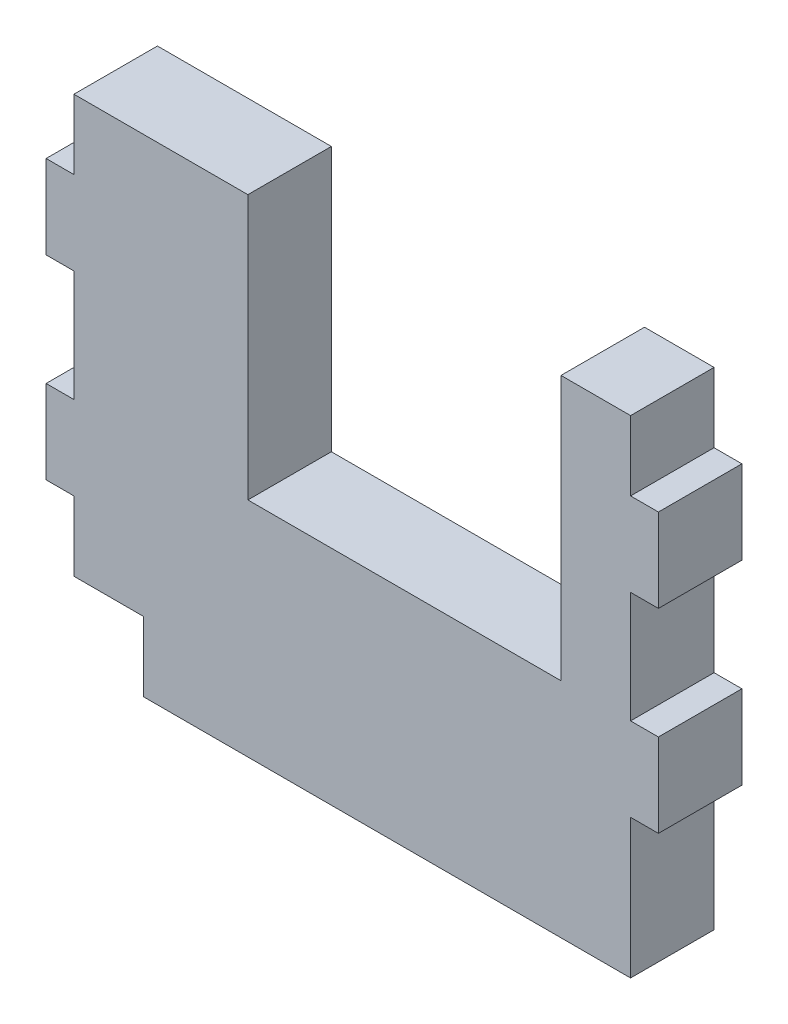
from build123d import *

# Parameters (mm, degrees)
EXTRUDE_1_DEPTH = 6


with BuildPart() as part:
    # Эскиз2 → Бобышка-Вытянуть1 (new body)
    with BuildSketch(Plane.XY):
        Polygon((35, 35), (40, 35), (40, 30), (42, 30), (42, 24), (40, 24), (40, 16), (42, 16), (42, 10), (40, 10), (40, 0), (5, 0), (5, 5), (0, 5), (0, 10), (-2, 10), (-2, 16), (0, 16), (0, 24), (-2, 24), (-2, 30), (0, 30), (0, 35), (12.5, 35), (12.5, 16), (35, 16), align=None)
    extrude(amount=EXTRUDE_1_DEPTH)


solid = part.part
